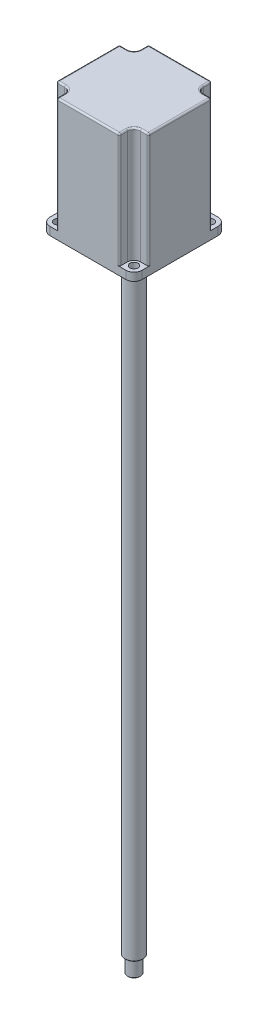
from build123d import *

# Parameters (mm, degrees)
SKETCH1_W                = 57
SKETCH1_H                = 57
EXTRUDE1_DEPTH           = 76
F_5_0_5_DIAMETER_HOLE1_D = 5
SKETCH6_R                = 4
SKETCH6_R_2              = 2.5
EXTRUDE4_DEPTH           = 71
FILLET1_R                = 5
SKETCH7_R                = 3
EXTRUDE5_DEPTH           = 101
SKETCH8_R                = 19.05
EXTRUDE6_DEPTH           = 3
FILLET2_R                = 1
SKETCH9_R                = 5.5
BOSS_EXTRUDE1_DEPTH      = 388
CHAMFER1_SIZE            = 0.5
SKETCH10_R               = 4
BOSS_EXTRUDE2_DEPTH      = 10
CHAMFER2_SIZE            = 0.5


with BuildPart() as part:
    # Sketch1 → Extrude1 (new body)
    with BuildSketch(Plane(origin=(0, 0, 0), x_dir=(1, 0, 0), z_dir=(0, 1, 0))):
        Rectangle(SKETCH1_W, SKETCH1_H)
    extrude(amount=EXTRUDE1_DEPTH)

    # Ø5.0 (5) Diameter Hole1 (through all)
    with Locations(Plane.XZ):
        with Locations((-23.5, 23.5), (23.5, 23.5), (23.5, -23.5), (-23.5, -23.5)):
            Hole(F_5_0_5_DIAMETER_HOLE1_D / 2)

    # Sketch6 → Extrude4 (cut)
    # profile 1 of 12: a face of its own
    with BuildSketch(Plane(origin=(0, 76, 0), x_dir=(1, 0, 0), z_dir=(0, 1, 0))):
        Polygon((-28.5, 28.5), (-19.5, 28.5), (-19.5, 32.511741208), (-33.908905561, 32.511741208), (-33.908905561, 19.5), (-28.5, 19.5), align=None)
    # profile 2 of 12: a face of its own
    with BuildSketch(Plane(origin=(0, 76, 0), x_dir=(1, 0, 0), z_dir=(0, 1, 0))):
        with BuildLine():
            ThreePointArc((-23.5, 19.5), (-26.328427125, 26.328427125), (-19.5, 23.5))
            Line((-19.5, 23.5), (-19.5, 28.5))
            Line((-19.5, 28.5), (-28.5, 28.5))
            Line((-28.5, 28.5), (-28.5, 19.5))
            Line((-28.5, 19.5), (-23.5, 19.5))
        make_face()
    # profile 3 of 12: a face of its own
    with BuildSketch(Plane(origin=(0, 76, 0), x_dir=(1, 0, 0), z_dir=(0, 1, 0))):
        with Locations((-23.5, 23.5)):
            Circle(SKETCH6_R)
        with Locations(Location((-23.5, 23.5, 0), (0, 0, 90))):
            Circle(SKETCH6_R_2, mode=Mode.SUBTRACT)
    # profile 4 of 12: a face of its own
    with BuildSketch(Plane(origin=(0, 76, 0), x_dir=(1, 0, 0), z_dir=(0, 1, 0))):
        Polygon((19.5, 36.471560472), (19.5, 28.5), (28.5, 28.5), (28.5, 19.5), (41.168352552, 19.5), (41.168352552, 36.471560472), align=None)
    # profile 5 of 12: a face of its own
    with BuildSketch(Plane(origin=(0, 76, 0), x_dir=(1, 0, 0), z_dir=(0, 1, 0))):
        with BuildLine():
            Line((28.5, 28.5), (19.5, 28.5))
            Line((19.5, 28.5), (19.5, 23.5))
            ThreePointArc((19.5, 23.5), (23.5, 27.5), (27.5, 23.5))
            ThreePointArc((27.5, 23.5), (26.328427125, 20.671572875), (23.5, 19.5))
            Line((23.5, 19.5), (28.5, 19.5))
            Line((28.5, 19.5), (28.5, 28.5))
        make_face()
    # profile 6 of 12: a face of its own
    with BuildSketch(Plane(origin=(0, 76, 0), x_dir=(1, 0, 0), z_dir=(0, 1, 0))):
        with Locations((23.5, 23.5)):
            Circle(SKETCH6_R)
        with Locations(Location((23.5, 23.5, 0), (0, 0, 90))):
            Circle(SKETCH6_R_2, mode=Mode.SUBTRACT)
    # profile 7 of 12: a face of its own
    with BuildSketch(Plane(origin=(0, 76, 0), x_dir=(1, 0, 0), z_dir=(0, 1, 0))):
        with Locations((23.5, -23.5)):
            Circle(SKETCH6_R)
        with Locations(Location((23.5, -23.5, 0), (0, 0, 90))):
            Circle(SKETCH6_R_2, mode=Mode.SUBTRACT)
    # profile 8 of 12: a face of its own
    with BuildSketch(Plane(origin=(0, 76, 0), x_dir=(1, 0, 0), z_dir=(0, 1, 0))):
        with BuildLine():
            Line((28.5, -28.5), (28.5, -19.5))
            Line((28.5, -19.5), (23.5, -19.5))
            ThreePointArc((23.5, -19.5), (26.328427125, -20.671572875), (27.5, -23.5))
            ThreePointArc((27.5, -23.5), (23.5, -27.5), (19.5, -23.5))
            Line((19.5, -23.5), (19.5, -28.5))
            Line((19.5, -28.5), (28.5, -28.5))
        make_face()
    # profile 9 of 12: a face of its own
    with BuildSketch(Plane(origin=(0, 76, 0), x_dir=(1, 0, 0), z_dir=(0, 1, 0))):
        Polygon((44.252209519, -19.5), (28.5, -19.5), (28.5, -28.5), (19.5, -28.5), (19.5, -40.050429997), (44.252209519, -40.050429997), align=None)
    # profile 10 of 12: a face of its own
    with BuildSketch(Plane(origin=(0, 76, 0), x_dir=(1, 0, 0), z_dir=(0, 1, 0))):
        Polygon((-28.5, -28.5), (-28.5, -19.5), (-37.670786859, -19.5), (-37.670786859, -37.828231874), (-19.5, -37.828231874), (-19.5, -28.5), align=None)
    # profile 11 of 12: a face of its own
    with BuildSketch(Plane(origin=(0, 76, 0), x_dir=(1, 0, 0), z_dir=(0, 1, 0))):
        with BuildLine():
            Line((-23.5, -19.5), (-28.5, -19.5))
            Line((-28.5, -19.5), (-28.5, -28.5))
            Line((-28.5, -28.5), (-19.5, -28.5))
            Line((-19.5, -28.5), (-19.5, -23.5))
            ThreePointArc((-19.5, -23.5), (-26.328427125, -26.328427125), (-23.5, -19.5))
        make_face()
    # profile 12 of 12: a face of its own
    with BuildSketch(Plane(origin=(0, 76, 0), x_dir=(1, 0, 0), z_dir=(0, 1, 0))):
        with Locations((-23.5, -23.5)):
            Circle(SKETCH6_R)
        with Locations(Location((-23.5, -23.5, 0), (0, 0, 90))):
            Circle(SKETCH6_R_2, mode=Mode.SUBTRACT)
    extrude(amount=-EXTRUDE4_DEPTH, mode=Mode.SUBTRACT)

    # Fillet1
    fillet1_edges = [part.edges().sort_by_distance(p)[0] for p in [
        (-28.5, 2.5, 28.5),
        (-28.5, 2.5, -28.5),
        (28.5, 2.5, -28.5),
        (28.5, 2.5, 28.5),
    ]]
    fillet(fillet1_edges, radius=FILLET1_R)



with BuildPart() as body_2:
    # Sketch7 → Extrude5 (new body)
    with BuildSketch(Plane(origin=(0, 76, 0), x_dir=(1, 0, 0), z_dir=(0, 1, 0))):
        with Locations(Location((0, 0, 0), (0, 0, 270))):
            Circle(SKETCH7_R)
    extrude(amount=-EXTRUDE5_DEPTH)


with BuildPart() as part_1:
    add(part.part)

    add(body_2.part)  # Extrude6 merges body 2
    # Sketch8 → Extrude6 (add)
    with BuildSketch(Plane.XZ):
        with Locations(Location((0, 0, 0), (0, 0, 270))):
            Circle(SKETCH8_R)
    extrude(amount=EXTRUDE6_DEPTH)

    # Fillet2
    fillet2_edges = [part_1.edges().sort_by_distance(p)[0] for p in [
        (-28.5, 40.5, 19.5),
        (0, 76, 28.5),
        (-19.5, 40.5, 28.5),
        (-19.5, 76, 26),
        (-20.671572875, 76, 20.671572875),
        (-26, 76, 19.5),
        (-28.5, 76, 0),
        (-28.5, 40.5, -19.5),
        (-19.5, 40.5, -28.5),
        (-19.5, 76, -26),
        (-26, 76, -19.5),
        (-20.671572875, 76, -20.671572875),
        (0, 76, -28.5),
        (19.5, 76, -26),
        (26, 76, -19.5),
        (20.671572875, 76, -20.671572875),
        (19.5, 40.5, -28.5),
        (28.5, 40.5, -19.5),
        (19.5, 40.5, 28.5),
        (28.5, 76, 0),
        (26, 76, 19.5),
        (19.5, 76, 26),
        (20.671572875, 76, 20.671572875),
        (28.5, 40.5, 19.5),
    ]]
    fillet(fillet2_edges, radius=FILLET2_R)

    # Sketch9 → Boss-Extrude1 (add)
    with BuildSketch(Plane.XZ):
        with Locations(Location((0, 0, 0), (0, 0, 90))):
            Circle(SKETCH9_R)
    extrude(amount=BOSS_EXTRUDE1_DEPTH)

    # Chamfer1
    chamfer1_edges = [part_1.edges().sort_by_distance(p)[0] for p in [
        (0, -388, -5.5),
    ]]
    chamfer(chamfer1_edges, length=CHAMFER1_SIZE)

    # Sketch10 → Boss-Extrude2 (add)
    with BuildSketch(Plane.XZ.offset(388)):
        with Locations(Location((0, 0, 0), (0, 0, 270))):
            Circle(SKETCH10_R)
    extrude(amount=BOSS_EXTRUDE2_DEPTH)

    # Chamfer2
    chamfer2_edges = [part_1.edges().sort_by_distance(p)[0] for p in [
        (0, -398, 4),
    ]]
    chamfer(chamfer2_edges, length=CHAMFER2_SIZE)


solid = part_1.part
